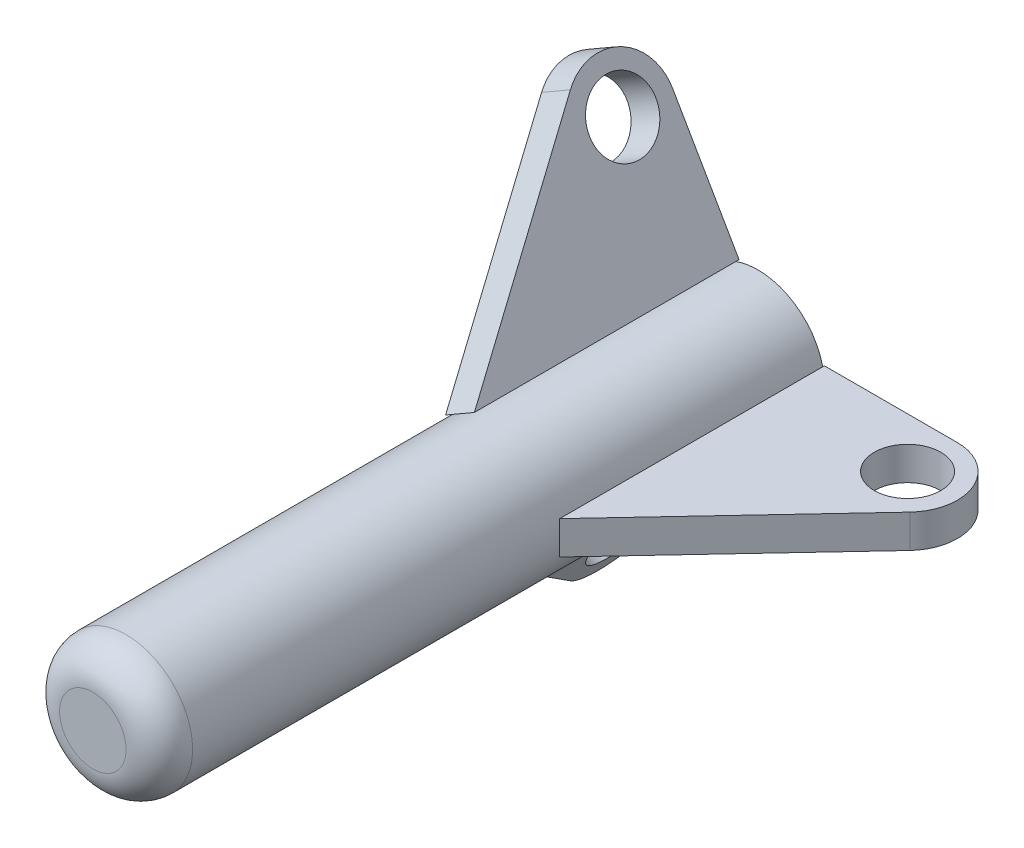
from build123d import *

# Parameters (mm, degrees)
SKETCH2_R           = 20
BOSS_EXTRUDE1_DEPTH = 200
FILLET1_R           = 10
SKETCH4_R           = 10
BOSS_EXTRUDE3_DEPTH = 5
CIRPATTERN4_COUNT   = 3


with BuildPart() as part:
    # Sketch2 → Boss-Extrude1 (new body)
    with BuildSketch(Plane.XY):
        Circle(SKETCH2_R)
    extrude(amount=BOSS_EXTRUDE1_DEPTH)

    # Fillet1
    fillet1_edges = [part.edges().sort_by_distance(p)[0] for p in [
        (-20, 0, 200),
    ]]
    fillet(fillet1_edges, radius=FILLET1_R)


with BuildPart() as body_2:
    # Sketch4 → Boss-Extrude3 (new, symmetric)
    with BuildSketch(Plane(origin=(0, 0, 0), x_dir=(1, 0, 0), z_dir=(0, 1, 0))):
        with BuildLine():
            ThreePointArc((60, 0), (73.763798723, -9.036960112), (70.943210773, -25.258954039))
            Line((70.943210773, -25.258954039), (20, -79.6))
            Line((20, -79.6), (20, 0))
            Line((20, 0), (60, 0))
        make_face()
        with Locations(Location((60, -15, 0), (0, 0, 270))):
            Circle(SKETCH4_R, mode=Mode.SUBTRACT)
    extrude(amount=BOSS_EXTRUDE3_DEPTH, both=True)


with BuildPart() as cirpattern4_1:
    # CirPattern4: pattern copy
    add(body_2.part.rotate(Axis((0, 0, 0), (0, 0, 1)), 1 * 360 / CIRPATTERN4_COUNT))


with BuildPart() as cirpattern4_2:
    # CirPattern4: pattern copy
    add(body_2.part.rotate(Axis((0, 0, 0), (0, 0, 1)), 2 * 360 / CIRPATTERN4_COUNT))


solid = Compound([part.part, body_2.part, cirpattern4_1.part, cirpattern4_2.part])
